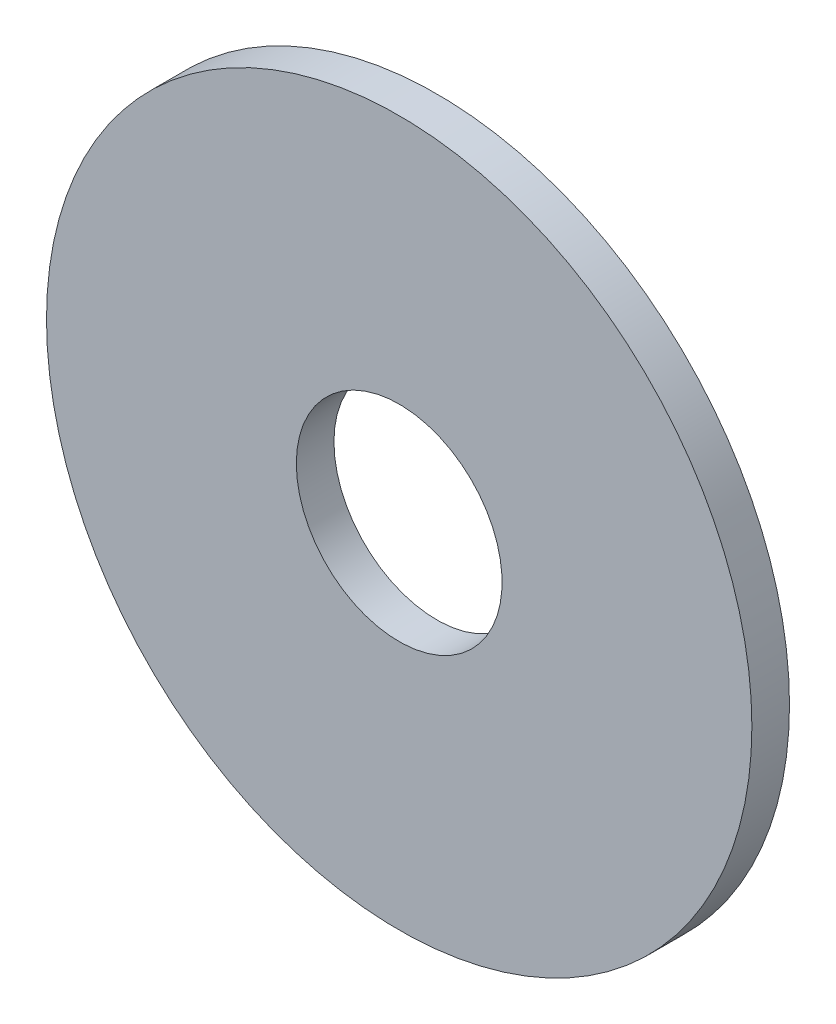
from build123d import *

# Parameters (mm, degrees)
SKETCH1_W = 2.032
SKETCH1_H = 13.49375


with BuildPart() as part:
    # Sketch1 → Revolve1 (revolve)
    with BuildSketch(Plane(origin=(0, 0, 0), x_dir=(0, 0, -1), z_dir=(1, 0, 0)), mode=Mode.PRIVATE) as revolve1_sk:
        with Locations((-1.016, 12.303125)):
            Rectangle(SKETCH1_W, SKETCH1_H)
    revolve(revolve1_sk.sketch.rotate(Axis((0, 0, 0), (0, 0, 1)), 90), axis=Axis((0, 0, 0), (0, 0, 1)))


solid = part.part
